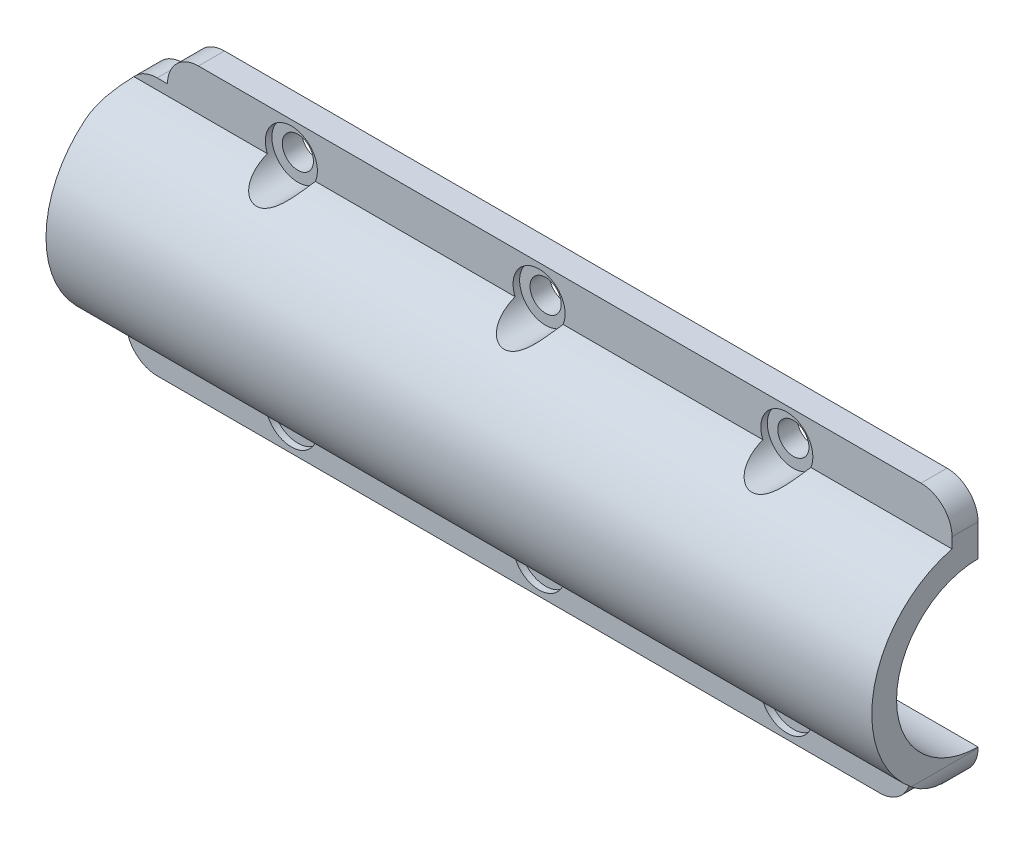
from build123d import *

# Parameters (mm, degrees)
BOSS_EXTRUDE1_DEPTH  = 114.3
CUT_EXTRUDE1_START   = -1
SKETCH2_R            = 4
CUT_EXTRUDE1_DEPTH   = 7.35
M4_CLEARANCE_HOLE1_D = 4.8
FILLET1_R            = 4.7625
BOSS_EXTRUDE2_START  = 6.35
BOSS_EXTRUDE2_DEPTH  = 6.35
BOSS_EXTRUDE3_DEPTH  = 6.35
FILLET2_R            = 4.7625


with BuildPart() as part:
    # Sketch1 → Boss-Extrude1 (new body)
    with BuildSketch(Plane(origin=(0, 0, 0), x_dir=(0, 0, -1), z_dir=(1, 0, 0))):
        with BuildLine():
            Line((0, 22.225), (-4, 22.225))
            Line((-4, 22.225), (-4, 15.839643355))
            ThreePointArc((-3.999999999, 15.839643349), (-2.01539476, 16.212109221), (0, 16.336899995))
            Line((0, 16.336899995), (0, 17.4625))
            Line((0, 17.4625), (0, 22.225))
        make_face()
        with BuildLine():
            ThreePointArc((0, 16.336899995), (-2.01539476, 16.212109221), (-3.999999999, 15.839643349))
            ThreePointArc((-3.999999999, 15.839643349), (-16.336899991, 0), (-3.999999999, -15.839643349))
            ThreePointArc((-3.999999999, -15.839643349), (-2.01539476, -16.212109221), (0, -16.336899995))
            Line((0, -16.336899995), (0, -12.5269))
            ThreePointArc((0, -12.5269), (-12.361865073, -2.026700652), (-4, 11.871108778))
            ThreePointArc((-4, 11.871108778), (-2.026700652, 12.361865073), (0, 12.5269))
            Line((0, 12.5269), (0, 16.336899995))
        make_face()
        with BuildLine():
            ThreePointArc((0, -16.336899995), (-2.01539476, -16.212109221), (-3.999999999, -15.839643349))
            Line((-4, -15.839643355), (-4, -22.225))
            Line((-4, -22.225), (0, -22.225))
            Line((0, -22.225), (0, -17.4625))
            Line((0, -17.4625), (0, -16.336899995))
        make_face()
    extrude(amount=BOSS_EXTRUDE1_DEPTH)

    # Sketch2 → Cut-Extrude1 (cut)
    with BuildSketch(Plane.XY.offset(4).offset(CUT_EXTRUDE1_START)):
        with Locations(Location((19.05, -17.37595, 0), (0, 0, 157.413569734))):
            Circle(SKETCH2_R)
        with Locations(Location((57.15, -17.37595, 0), (0, 0, 157.413569734))):
            Circle(SKETCH2_R)
        with Locations(Location((95.25, -17.37595, 0), (0, 0, 157.413569734))):
            Circle(SKETCH2_R)
    cut_extrude1 = extrude(amount=CUT_EXTRUDE1_DEPTH, mode=Mode.SUBTRACT)

    # M4 Clearance Hole1 (through all)
    with Locations(Plane.XY.offset(4)):
        with Locations((19.05, -17.37595), (57.15, -17.37595), (95.25, -17.37595)):
            m4_clearance_hole1 = Hole(M4_CLEARANCE_HOLE1_D / 2)

    # Mirror1: Cut-Extrude1, M4 Clearance Hole1 across plane
    add(cut_extrude1.mirror(Plane.ZX), mode=Mode.SUBTRACT)
    add(m4_clearance_hole1.mirror(Plane.ZX), mode=Mode.SUBTRACT)

    # Fillet1
    fillet1_edges = [part.edges().sort_by_distance(p)[0] for p in [
        (0, 22.225, 2),
        (114.3, -22.225, 2),
    ]]
    fillet(fillet1_edges, radius=FILLET1_R)

    # Sketch8 → Boss-Extrude2 (add)
    with BuildSketch(Plane.ZY.offset(BOSS_EXTRUDE2_START)):
        with BuildLine():
            Line((3.999999999, 15.839643352), (4, 17.4625))
            Line((4, 17.4625), (0, 17.4625))
            Line((0, 17.4625), (0, 12.5269))
            ThreePointArc((0, 12.5269), (12.5269, 0), (0, -12.5269))
            Line((0, -12.5269), (0, -22.225))
            Line((0, -22.225), (4, -22.225))
            Line((4, -22.225), (3.999999999, -15.839643352))
            ThreePointArc((3.999999999, -15.839643352), (16.336899994, 0), (3.999999999, 15.839643352))
        make_face()
    extrude(amount=-BOSS_EXTRUDE2_DEPTH)

    # Sketch9 → Boss-Extrude3 (add)
    with BuildSketch(Plane(origin=(114.3, 0, 0), x_dir=(0, 0, -1), z_dir=(1, 0, 0))):
        with BuildLine():
            Line((-3.999999999, -15.839643352), (-4, -17.4625))
            Line((-4, -17.4625), (0, -17.4625))
            Line((0, -17.4625), (0, -12.5269))
            ThreePointArc((0, -12.5269), (-12.5269, 0), (0, 12.5269))
            Line((0, 12.5269), (0, 22.225))
            Line((0, 22.225), (-4, 22.225))
            Line((-4, 22.225), (-3.999999999, 15.839643352))
            ThreePointArc((-3.999999999, 15.839643352), (-16.336899994, 0), (-3.999999999, -15.839643352))
        make_face()
    extrude(amount=BOSS_EXTRUDE3_DEPTH)

    # Fillet2
    fillet2_edges = [part.edges().sort_by_distance(p)[0] for p in [
        (-6.35, 17.4625, 2),
        (-6.35, -22.225, 2),
        (120.65, -17.4625, 2),
        (120.65, 22.225, 2),
    ]]
    fillet(fillet2_edges, radius=FILLET2_R)


solid = part.part
